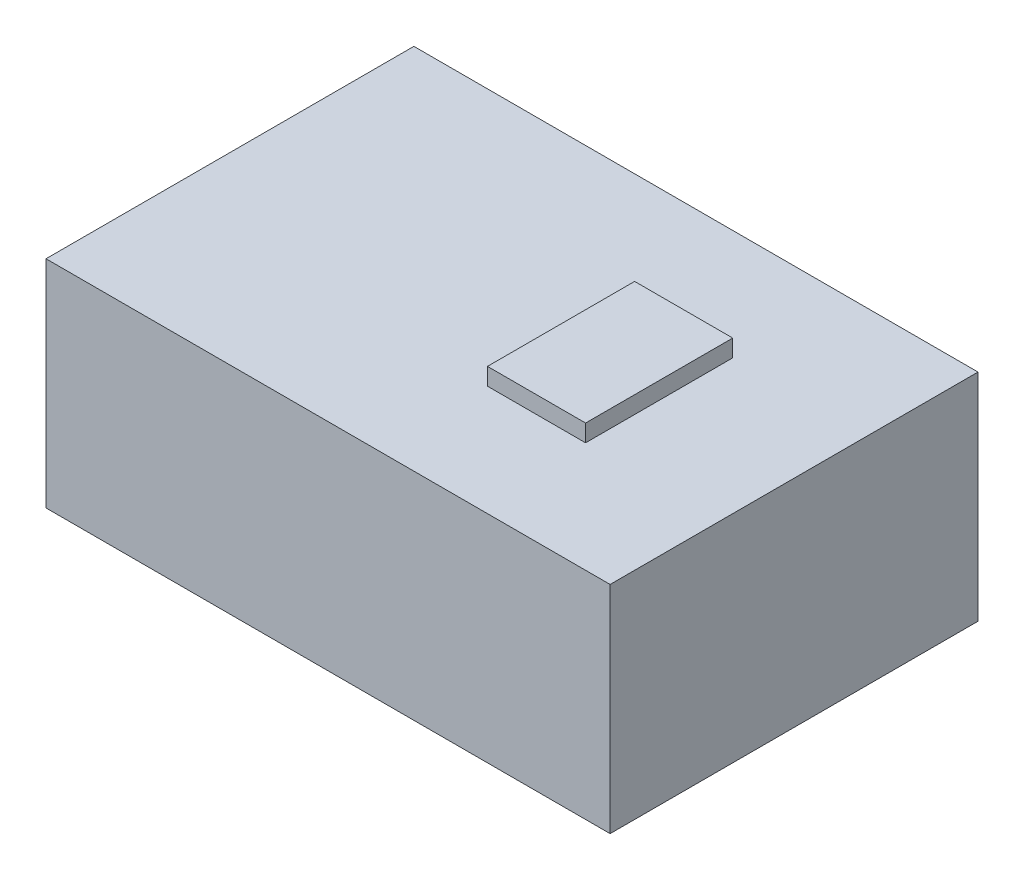
from build123d import *

# Parameters (mm, degrees)
SKETCH1_W           = 46
SKETCH1_H           = 17.6
BOSS_EXTRUDE1_DEPTH = 30
SKETCH2_W           = 8
SKETCH2_H           = 1.4
BOSS_EXTRUDE2_DEPTH = 12


with BuildPart() as part:
    # Sketch1 → Boss-Extrude1 (new body)
    with BuildSketch(Plane.XY.offset(11)):
        with Locations((-8, -117.7)):
            Rectangle(SKETCH1_W, SKETCH1_H)
    extrude(amount=BOSS_EXTRUDE1_DEPTH)

    # Sketch2 → Boss-Extrude2 (add)
    with BuildSketch(Plane.XY.offset(20)):
        with Locations((0, -108.2)):
            Rectangle(SKETCH2_W, SKETCH2_H)
    extrude(amount=BOSS_EXTRUDE2_DEPTH)


solid = part.part
